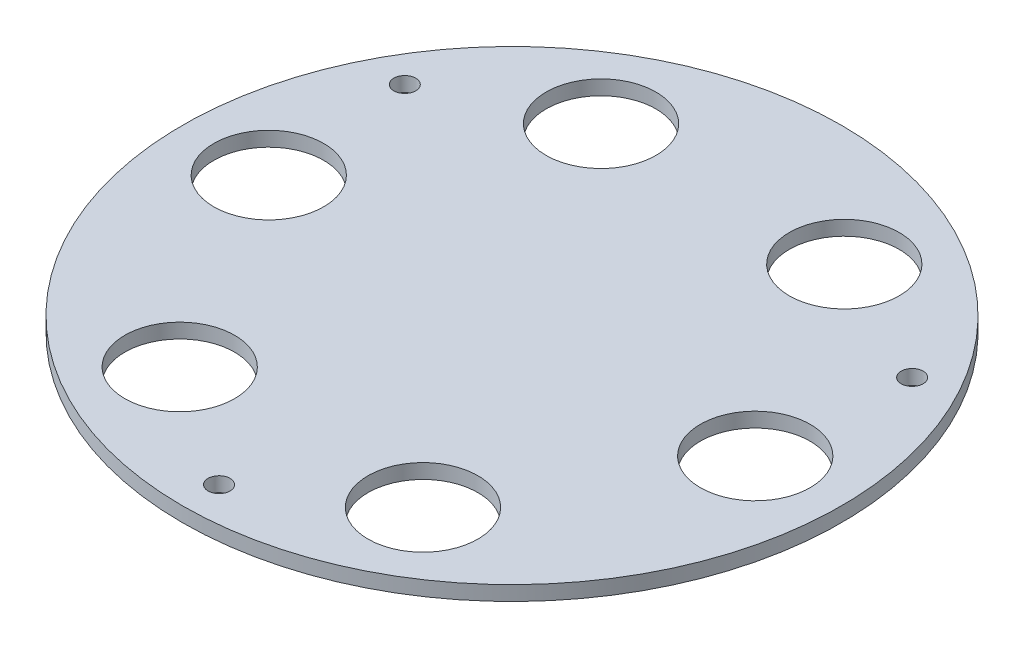
from build123d import *

# Parameters (mm, degrees)
SKETCH1_R                = 45
BOSS_EXTRUDE1_DEPTH      = 2
F_8_0MM_DOWEL_HOLE1_D    = 15
F_3_0_3_DIAMETER_HOLE1_D = 3


with BuildPart() as part:
    # Sketch1 → Boss-Extrude1 (new body)
    with BuildSketch(Plane(origin=(0, 0, 0), x_dir=(1, 0, 0), z_dir=(0, 1, 0))):
        with Locations(Location((0, 0, 0), (0, 0, 270))):
            Circle(SKETCH1_R)
    extrude(amount=-BOSS_EXTRUDE1_DEPTH)

    # Ø8.0mm Dowel Hole1 (through all)
    with Locations(Plane(origin=(0, 0, 0), x_dir=(1, 0, 0), z_dir=(0, 1, 0))):
        with Locations((-16.606971943, 28.764119165), (-16.606971943, -28.764119165), (33.213943886, 0), (16.606971943, 28.764119165), (16.606971943, -28.764119165), (-33.213943886, 0)):
            Hole(F_8_0MM_DOWEL_HOLE1_D / 2)

    # Ø3.0 (3) Diameter Hole1 (through all)
    with Locations(Plane(origin=(0, 0, 0), x_dir=(1, 0, 0), z_dir=(0, 1, 0))):
        with Locations((-34.641016151, 20), (0, -40), (34.641016151, 20)):
            Hole(F_3_0_3_DIAMETER_HOLE1_D / 2)


solid = part.part
